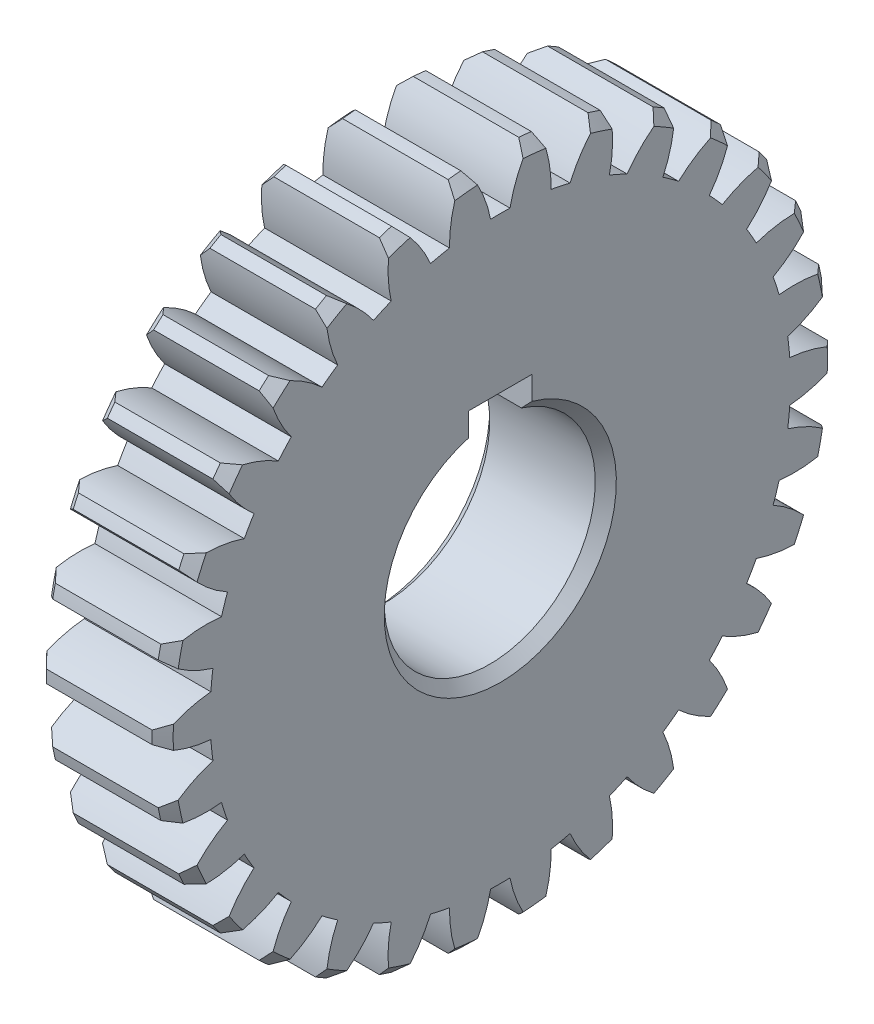
from build123d import *

# Parameters (mm, degrees)
BASPROSKE_W     = 12
BASPROSKE_H     = 32
TOOTHCUT_DEPTH  = 47.818799643
TEETHCUTS_COUNT = 30
TEETHCUTS_ANGLE = 348
BORSKE_R        = 10
BORE_DEPTH      = 50.0000508
KEYSKE_W        = 6
KEYSKE_H        = 12.8
KEYWAY_DEPTH    = 50.0000508
CHAMFER1_SIZE   = 1


with BuildPart() as part:
    # BasProSke → Base-Revolve (revolve)
    with BuildSketch(Plane(origin=(0, 0, 0), x_dir=(1, 0, 0), z_dir=(0, 1, 0)), mode=Mode.PRIVATE) as base_revolve_sk:
        with Locations((6, 16)):
            Rectangle(BASPROSKE_W, BASPROSKE_H)
    revolve(base_revolve_sk.sketch.rotate(Axis((-10, 0, 0), (1, 0, 0)), 180), axis=Axis((-10, 0, 0), (1, 0, 0)))

    # TooCutSke → ToothCut (cut, through all)
    with BuildSketch(Plane(origin=(0, 0, 0), x_dir=(0, 0, -1), z_dir=(1, 0, 0))):
        with BuildLine():
            ThreePointArc((0.918551563, 27.483654488), (0, 27.499), (-0.918551563, 27.483654488))
            ThreePointArc((-0.918551563, 27.483654488), (-1.617208176, 29.787801627), (-2.761784709, 31.906093311))
            ThreePointArc((-2.761784709, 31.906093311), (0, 32.0254), (2.761784709, 31.906093311))
            ThreePointArc((2.761784709, 31.906093311), (1.617208176, 29.787801627), (0.918551563, 27.483654488))
        make_face()
    toothcut = extrude(amount=TOOTHCUT_DEPTH, mode=Mode.SUBTRACT)

    # TeethCuts: ToothCut ×30 about axis
    teethcuts_axis = Axis((-10, 0, 0), (1, 0, 0))
    for i in range(1, TEETHCUTS_COUNT):
        add(toothcut.rotate(teethcuts_axis, i * TEETHCUTS_ANGLE / (TEETHCUTS_COUNT - 1)), mode=Mode.SUBTRACT)

    # BorSke → Bore (cut, symmetric)
    with BuildSketch(Plane(origin=(0, 0, 0), x_dir=(0, 0, -1), z_dir=(1, 0, 0))):
        with Locations(Location((0, 0, 0), (0, 0, 180))):
            Circle(BORSKE_R)
    extrude(amount=BORE_DEPTH, both=True, mode=Mode.SUBTRACT)

    # KeySke → Keyway (cut, symmetric)
    with BuildSketch(Plane(origin=(0, 0, 0), x_dir=(0, 0, -1), z_dir=(1, 0, 0))):
        with Locations((0, 6.4)):
            Rectangle(KEYSKE_W, KEYSKE_H)
    extrude(amount=KEYWAY_DEPTH, both=True, mode=Mode.SUBTRACT)

    # Chamfer1
    chamfer1_edges = [part.edges().sort_by_distance(p)[0] for p in [
        (12, 30.433808521, -9.88854382),
        (12, 27.712812921, -16),
        (12, 23.780634415, -21.412179403),
        (12, 18.809128073, -25.88854382),
        (12, 13.015572578, -29.233454645),
        (12, 6.653174106, -31.300723223),
        (12, 0, -32),
        (12, -6.653174106, -31.300723223),
        (12, -13.015572578, -29.233454645),
        (12, -18.809128073, -25.88854382),
        (12, -23.780634415, -21.412179403),
        (12, -27.712812921, -16),
        (12, 31.824700652, -3.344910825),
        (12, -30.433808521, -9.88854382),
        (12, -31.824700652, -3.344910825),
        (12, -31.824700652, 3.344910825),
        (12, -30.433808521, 9.88854382),
        (12, -27.712812921, 16),
        (12, -23.780634415, 21.412179403),
        (12, -18.809128073, 25.88854382),
        (12, -13.015572578, 29.233454645),
        (12, -6.653174106, 31.300723223),
        (12, 0, 32),
        (12, 6.653174106, 31.300723223),
        (12, 13.015572578, 29.233454645),
        (12, 18.809128073, 25.88854382),
        (12, 23.780634415, 21.412179403),
        (12, 27.712812921, 16),
        (12, 30.433808521, 9.88854382),
        (0, 31.824700652, 3.344910825),
        (12, 31.824700652, 3.344910825),
        (0, 30.433808521, -9.88854382),
        (0, 27.712812921, -16),
        (0, 23.780634415, -21.412179403),
        (0, 18.809128073, -25.88854382),
        (0, 13.015572578, -29.233454645),
        (0, 6.653174106, -31.300723223),
        (0, 0, -32),
        (0, -6.653174106, -31.300723223),
        (0, -13.015572578, -29.233454645),
        (0, -18.809128073, -25.88854382),
        (0, -23.780634415, -21.412179403),
        (0, -27.712812921, -16),
        (0, -30.433808521, -9.88854382),
        (0, -31.824700652, -3.344910825),
        (0, -31.824700652, 3.344910825),
        (0, -30.433808521, 9.88854382),
        (0, -27.712812921, 16),
        (0, -23.780634415, 21.412179403),
        (0, -18.809128073, 25.88854382),
        (0, -13.015572578, 29.233454645),
        (0, -6.653174106, 31.300723223),
        (0, -10, 0),
        (12, -10, 0),
        (0, 0, 32),
        (0, 6.653174106, 31.300723223),
        (0, 13.015572578, 29.233454645),
        (0, 18.809128073, 25.88854382),
        (0, 23.780634415, 21.412179403),
        (0, 27.712812921, 16),
        (0, 30.433808521, 9.88854382),
        (0, 31.824700652, -3.344910825),
    ]]
    chamfer(chamfer1_edges, length=CHAMFER1_SIZE)


solid = part.part
